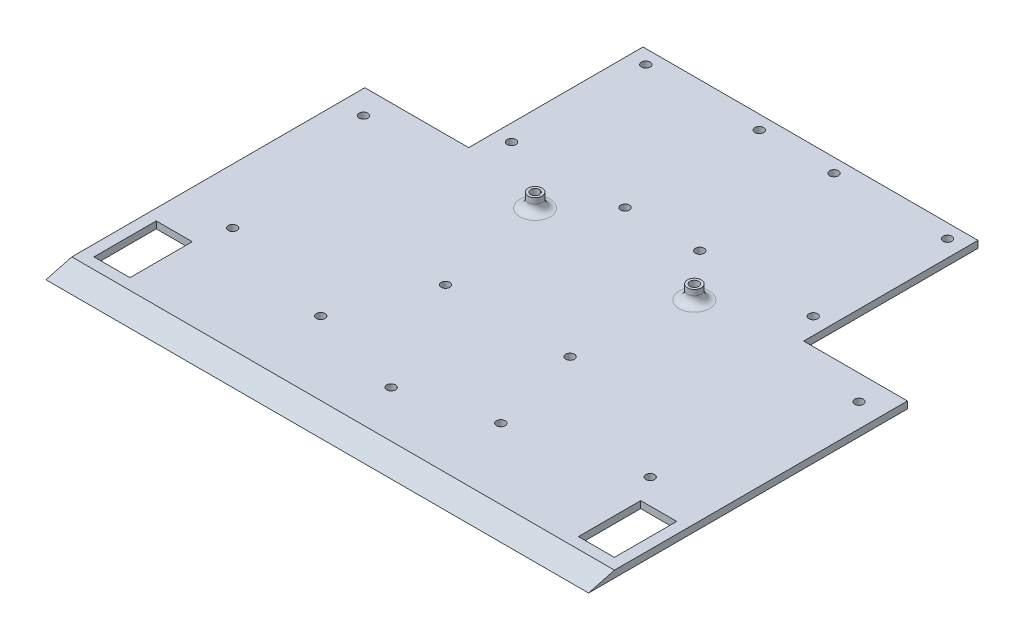
from build123d import *

# Parameters (mm, degrees)
SALIENTE_EXTRUIR1_DEPTH = 196
CORTAR_EXTRUIR1_REACH   = 266.89
CROQUIS2_W              = 37.5
CROQUIS2_H              = 62.989872981
CORTAR_EXTRUIR2_REACH   = 266.89
CROQUIS4_W              = 13
CROQUIS4_H              = 22.5
CUT_EXTRUDE1_REACH      = 266.89
SKETCH1_R               = 1.585
CUT_EXTRUDE2_REACH      = 266.89
SKETCH2_R               = 1.585
CUT_EXTRUDE3_REACH      = 266.89
SKETCH3_R               = 1.585
SKETCH4_R               = 2.5
SKETCH4_R_2             = 1.6
BOSS_EXTRUDE1_DEPTH     = 5
SKETCH8_R               = 1.6
CUT_EXTRUDE6_DEPTH      = 265.925553505
FILLET1_R               = 3
SKETCH12_R              = 1.575419973
CUT_EXTRUDE9_DEPTH      = 10
SKETCH14_R              = 1.575419973
CUT_EXTRUDE10_DEPTH     = 10


with BuildPart() as part:
    # Croquis1 → Saliente-Extruir1 (new body)
    with BuildSketch(Plane(origin=(0, 0, 0), x_dir=(0, 0, -1), z_dir=(1, 0, 0))):
        Polygon((0, 0), (178.17, 0), (178.17, 2.5), (9.330127019, 2.5), align=None)
    extrude(amount=SALIENTE_EXTRUIR1_DEPTH)

    # Croquis2 → Cortar-Extruir1 (cut, up to next)
    with BuildSketch(Plane(origin=(0, 0, 0), x_dir=(-1, 0, 0), z_dir=(0, -1, 0)), mode=Mode.PRIVATE) as cortar_extruir1_sk1:
        with Locations((-18.75, 146.67506351)):
            Rectangle(CROQUIS2_W, CROQUIS2_H)
    cortar_extruir1_tool1 = extrude(cortar_extruir1_sk1.sketch, amount=-CORTAR_EXTRUIR1_REACH, mode=Mode.PRIVATE) & part.part
    # Croquis2 → Cortar-Extruir1 (cut, up to next)
    with BuildSketch(Plane(origin=(0, 0, 0), x_dir=(-1, 0, 0), z_dir=(0, -1, 0)), mode=Mode.PRIVATE) as cortar_extruir1_sk2:
        with Locations((-177.25, 146.67506351)):
            Rectangle(CROQUIS2_W, CROQUIS2_H)
    cortar_extruir1_tool2 = extrude(cortar_extruir1_sk2.sketch, amount=-CORTAR_EXTRUIR1_REACH, mode=Mode.PRIVATE) & part.part
    add(cortar_extruir1_tool1.solids().sort_by_distance((18.75, 0, -146.675064))[0], mode=Mode.SUBTRACT)
    add(cortar_extruir1_tool2.solids().sort_by_distance((177.25, 0, -146.675064))[0], mode=Mode.SUBTRACT)

    # Croquis4 → Cortar-Extruir2 (cut, up to next)
    with BuildSketch(Plane(origin=(0, 2.5, 0), x_dir=(1, 0, 0), z_dir=(0, 1, 0)), mode=Mode.PRIVATE) as cortar_extruir2_sk1:
        with Locations((10.5, 24.580127019)):
            Rectangle(CROQUIS4_W, CROQUIS4_H)
    cortar_extruir2_tool1 = extrude(cortar_extruir2_sk1.sketch, amount=-CORTAR_EXTRUIR2_REACH, mode=Mode.PRIVATE) & part.part
    cortar_extruir2 = cortar_extruir2_tool1.solids().sort_by_distance((10.5, 2.5, -24.580127))[0]
    add(cortar_extruir2, mode=Mode.SUBTRACT)

    # Simetría1: Cortar-Extruir2 across plane
    add(cortar_extruir2.mirror(Plane(origin=(98, 0, 0), x_dir=(0, 0, 1), z_dir=(1, 0, 0))), mode=Mode.SUBTRACT)

    # Sketch1 → Cut-Extrude1 (cut, up to next)
    with BuildSketch(Plane(origin=(0, 2.5, 0), x_dir=(1, 0, 0), z_dir=(0, 1, 0)), mode=Mode.PRIVATE) as cut_extrude1_sk1:
        with Locations(Location((187.5, 106.180127019, 0), (0, 0, 270))):
            Circle(SKETCH1_R)
    cut_extrude1_tool1 = extrude(cut_extrude1_sk1.sketch, amount=-CUT_EXTRUDE1_REACH, mode=Mode.PRIVATE) & part.part
    # Sketch1 → Cut-Extrude1 (cut, up to next)
    with BuildSketch(Plane(origin=(0, 2.5, 0), x_dir=(1, 0, 0), z_dir=(0, 1, 0)), mode=Mode.PRIVATE) as cut_extrude1_sk2:
        with Locations(Location((8.5, 106.180127019, 0), (0, 0, 270))):
            Circle(SKETCH1_R)
    cut_extrude1_tool2 = extrude(cut_extrude1_sk2.sketch, amount=-CUT_EXTRUDE1_REACH, mode=Mode.PRIVATE) & part.part
    add(cut_extrude1_tool1.solids().sort_by_distance((187.5, 2.5, -106.180127))[0], mode=Mode.SUBTRACT)
    add(cut_extrude1_tool2.solids().sort_by_distance((8.5, 2.5, -106.180127))[0], mode=Mode.SUBTRACT)

    # Sketch2 → Cut-Extrude2 (cut, up to next)
    with BuildSketch(Plane(origin=(0, 2.5, 0), x_dir=(1, 0, 0), z_dir=(0, 1, 0)), mode=Mode.PRIVATE) as cut_extrude2_sk1:
        with Locations(Location((98.5, 26.180127019, 0), (0, 0, 270))):
            Circle(SKETCH2_R)
    cut_extrude2_tool1 = extrude(cut_extrude2_sk1.sketch, amount=-CUT_EXTRUDE2_REACH, mode=Mode.PRIVATE) & part.part
    add(cut_extrude2_tool1.solids().sort_by_distance((98.5, 2.5, -26.180127))[0], mode=Mode.SUBTRACT)

    # Sketch3 → Cut-Extrude3 (cut, up to next)
    with BuildSketch(Plane(origin=(0, 2.5, 0), x_dir=(1, 0, 0), z_dir=(0, 1, 0)), mode=Mode.PRIVATE) as cut_extrude3_sk1:
        with Locations(Location((111.5, 124.67, 0), (0, 0, 270))):
            Circle(SKETCH3_R)
    cut_extrude3_tool1 = extrude(cut_extrude3_sk1.sketch, amount=-CUT_EXTRUDE3_REACH, mode=Mode.PRIVATE) & part.part
    # Sketch3 → Cut-Extrude3 (cut, up to next)
    with BuildSketch(Plane(origin=(0, 2.5, 0), x_dir=(1, 0, 0), z_dir=(0, 1, 0)), mode=Mode.PRIVATE) as cut_extrude3_sk2:
        with Locations(Location((152.5, 124.67, 0), (0, 0, 270))):
            Circle(SKETCH3_R)
    cut_extrude3_tool2 = extrude(cut_extrude3_sk2.sketch, amount=-CUT_EXTRUDE3_REACH, mode=Mode.PRIVATE) & part.part
    # Sketch3 → Cut-Extrude3 (cut, up to next)
    with BuildSketch(Plane(origin=(0, 2.5, 0), x_dir=(1, 0, 0), z_dir=(0, 1, 0)), mode=Mode.PRIVATE) as cut_extrude3_sk3:
        with Locations(Location((152.5, 173.17, 0), (0, 0, 270))):
            Circle(SKETCH3_R)
    cut_extrude3_tool3 = extrude(cut_extrude3_sk3.sketch, amount=-CUT_EXTRUDE3_REACH, mode=Mode.PRIVATE) & part.part
    # Sketch3 → Cut-Extrude3 (cut, up to next)
    with BuildSketch(Plane(origin=(0, 2.5, 0), x_dir=(1, 0, 0), z_dir=(0, 1, 0)), mode=Mode.PRIVATE) as cut_extrude3_sk4:
        with Locations(Location((111.5, 173.17, 0), (0, 0, 270))):
            Circle(SKETCH3_R)
    cut_extrude3_tool4 = extrude(cut_extrude3_sk4.sketch, amount=-CUT_EXTRUDE3_REACH, mode=Mode.PRIVATE) & part.part
    # Sketch3 → Cut-Extrude3 (cut, up to next)
    with BuildSketch(Plane(origin=(0, 2.5, 0), x_dir=(1, 0, 0), z_dir=(0, 1, 0)), mode=Mode.PRIVATE) as cut_extrude3_sk5:
        with Locations(Location((84.5, 173.17, 0), (0, 0, 270))):
            Circle(SKETCH3_R)
    cut_extrude3_tool5 = extrude(cut_extrude3_sk5.sketch, amount=-CUT_EXTRUDE3_REACH, mode=Mode.PRIVATE) & part.part
    # Sketch3 → Cut-Extrude3 (cut, up to next)
    with BuildSketch(Plane(origin=(0, 2.5, 0), x_dir=(1, 0, 0), z_dir=(0, 1, 0)), mode=Mode.PRIVATE) as cut_extrude3_sk6:
        with Locations(Location((43.5, 173.17, 0), (0, 0, 270))):
            Circle(SKETCH3_R)
    cut_extrude3_tool6 = extrude(cut_extrude3_sk6.sketch, amount=-CUT_EXTRUDE3_REACH, mode=Mode.PRIVATE) & part.part
    # Sketch3 → Cut-Extrude3 (cut, up to next)
    with BuildSketch(Plane(origin=(0, 2.5, 0), x_dir=(1, 0, 0), z_dir=(0, 1, 0)), mode=Mode.PRIVATE) as cut_extrude3_sk7:
        with Locations(Location((43.5, 124.67, 0), (0, 0, 270))):
            Circle(SKETCH3_R)
    cut_extrude3_tool7 = extrude(cut_extrude3_sk7.sketch, amount=-CUT_EXTRUDE3_REACH, mode=Mode.PRIVATE) & part.part
    # Sketch3 → Cut-Extrude3 (cut, up to next)
    with BuildSketch(Plane(origin=(0, 2.5, 0), x_dir=(1, 0, 0), z_dir=(0, 1, 0)), mode=Mode.PRIVATE) as cut_extrude3_sk8:
        with Locations(Location((84.5, 124.67, 0), (0, 0, 270))):
            Circle(SKETCH3_R)
    cut_extrude3_tool8 = extrude(cut_extrude3_sk8.sketch, amount=-CUT_EXTRUDE3_REACH, mode=Mode.PRIVATE) & part.part
    add(cut_extrude3_tool1.solids().sort_by_distance((111.5, 2.5, -124.67))[0], mode=Mode.SUBTRACT)
    add(cut_extrude3_tool2.solids().sort_by_distance((152.5, 2.5, -124.67))[0], mode=Mode.SUBTRACT)
    add(cut_extrude3_tool3.solids().sort_by_distance((152.5, 2.5, -173.17))[0], mode=Mode.SUBTRACT)
    add(cut_extrude3_tool4.solids().sort_by_distance((111.5, 2.5, -173.17))[0], mode=Mode.SUBTRACT)
    add(cut_extrude3_tool5.solids().sort_by_distance((84.5, 2.5, -173.17))[0], mode=Mode.SUBTRACT)
    add(cut_extrude3_tool6.solids().sort_by_distance((43.5, 2.5, -173.17))[0], mode=Mode.SUBTRACT)
    add(cut_extrude3_tool7.solids().sort_by_distance((43.5, 2.5, -124.67))[0], mode=Mode.SUBTRACT)
    add(cut_extrude3_tool8.solids().sort_by_distance((84.5, 2.5, -124.67))[0], mode=Mode.SUBTRACT)

    # Sketch4 → Boss-Extrude1 (add)
    # profile 1 of 2: a face of its own
    with BuildSketch(Plane(origin=(0, 2.5, 0), x_dir=(1, 0, 0), z_dir=(0, 1, 0))):
        with Locations(Location((68.415265875, 108.280438226, 0), (0, 0, 90))):
            Circle(SKETCH4_R)
        with Locations(Location((68.415265875, 108.280438226, 0), (0, 0, 270))):
            Circle(SKETCH4_R_2, mode=Mode.SUBTRACT)
    # profile 2 of 2: a face of its own
    with BuildSketch(Plane(origin=(0, 2.5, 0), x_dir=(1, 0, 0), z_dir=(0, 1, 0))):
        with Locations(Location((125.876416732, 108.336862559, 0), (0, 0, 90))):
            Circle(SKETCH4_R)
        with Locations(Location((125.876416732, 108.336862559, 0), (0, 0, 270))):
            Circle(SKETCH4_R_2, mode=Mode.SUBTRACT)
    extrude(amount=BOSS_EXTRUDE1_DEPTH)

    # Sketch8 → Cut-Extrude6 (cut, through all)
    with BuildSketch(Plane(origin=(0, 2.5, 0), x_dir=(1, 0, 0), z_dir=(0, 1, 0))):
        with Locations(Location((68.415265875, 108.280438226, 0), (0, 0, 270))):
            Circle(SKETCH8_R)
        with Locations(Location((125.876416732, 108.336862559, 0), (0, 0, 270))):
            Circle(SKETCH8_R)
    extrude(amount=-CUT_EXTRUDE6_DEPTH, mode=Mode.SUBTRACT)

    # Fillet1
    fillet1_edges = [part.edges().sort_by_distance(p)[0] for p in [
        (68.415265875, 2.5, -105.780438226),
        (125.876416732, 2.5, -105.836862559),
    ]]
    fillet(fillet1_edges, radius=FILLET1_R)

    # Sketch12 → Cut-Extrude9 (cut)
    with BuildSketch(Plane(origin=(0, 2.5, 0), x_dir=(1, 0, 0), z_dir=(0, 1, 0))):
        with Locations(Location((20.010826356, 47.41770363, 0), (0, 0, 270))):
            Circle(SKETCH12_R)
        with Locations(Location((63.468062002, 35.773372434, 0), (0, 0, 270))):
            Circle(SKETCH12_R)
        with Locations(Location((129.523650189, 34.779634544, 0), (0, 0, 270))):
            Circle(SKETCH12_R)
        with Locations(Location((173.36079416, 44.900236676, 0), (0, 0, 270))):
            Circle(SKETCH12_R)
    extrude(amount=-CUT_EXTRUDE9_DEPTH, mode=Mode.SUBTRACT)

    # Sketch14 → Cut-Extrude10 (cut)
    with BuildSketch(Plane(origin=(0, 2.5, 0), x_dir=(1, 0, 0), z_dir=(0, 1, 0))):
        with Locations(Location((76.242264521, 68.095650208, 0), (0, 0, 270))):
            Circle(SKETCH14_R)
        with Locations(Location((121.232505451, 68.095650208, 0), (0, 0, 270))):
            Circle(SKETCH14_R)
    extrude(amount=-CUT_EXTRUDE10_DEPTH, mode=Mode.SUBTRACT)


solid = part.part
